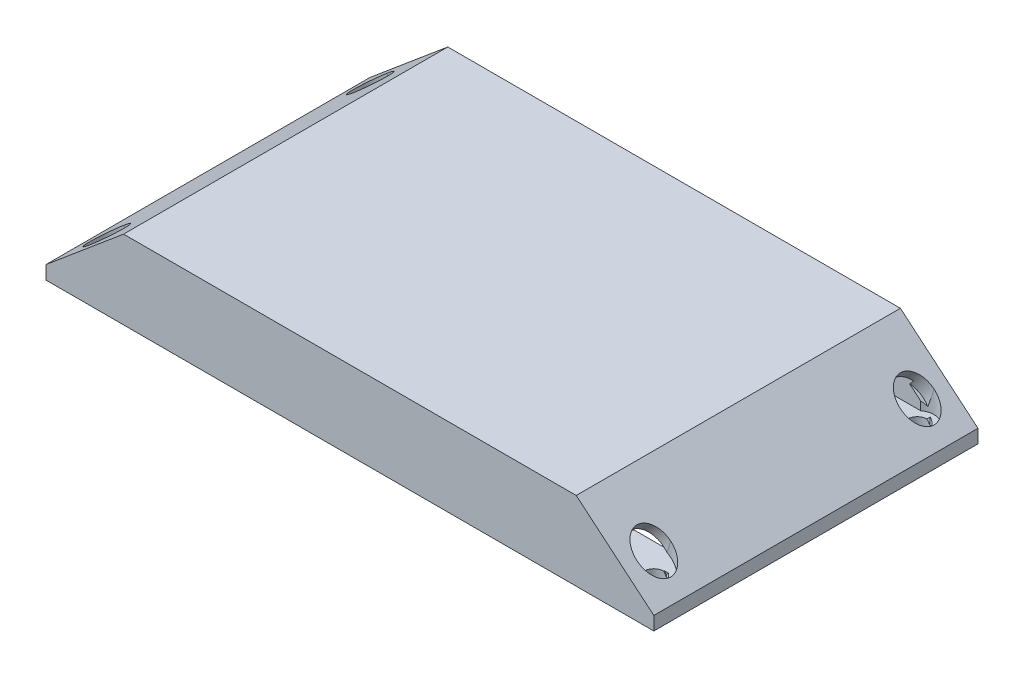
from build123d import *
from build123d.topology import SkipClean

# Parameters (mm, degrees)
SKICA1_W                 = 90
SKICA1_H                 = 48
SKICA1_W_2               = 85
SKICA1_H_2               = 43
P_IDAT_VYSUNUT_M1_DEPTH  = 2
P_IDAT_VYSUNUT_M2_DEPTH  = 2.5
P_IDAT_VYSUNUT_M3_DEPTH  = 43
P_IDAT_START             = -45.5
P_IDAT_VYSUNUT_M4_DEPTH  = 2.5
SKICA5_R                 = 2.5
SKICA5_R_2               = 1.4
P_IDAT_VYSUNUT_M5_DEPTH  = 6
ODEBRAT_START            = -3.5
SKICA6_R                 = 2.5
ODEBRAT_VYSUNUT_M1_DEPTH = 3.5
SKICA7_RX                = 3.26280462
SKICA7_RY                = 2.499223228
SKICA7_RX_2              = 3.263518223
SKICA7_RY_2              = 2.5
ODEBRAT_VYSUNUT_M2_DEPTH = 2.5
SKICA8_RX                = 3.263518223
SKICA8_RY                = 2.5
ODEBRAT_VYSUNUT_M3_DEPTH = 2.5
P_IDAT_VYSUNUT_M7_DEPTH  = 2.5
SKICA12_W                = 1.5
SKICA12_H                = 6.5
P_IDAT_VYSUNUT_M8_DEPTH  = 11.5


with BuildPart() as part:
    # Skica1 → Přidat vysunutím1 (new body)
    with BuildSketch(Plane(origin=(0, 0, 0), x_dir=(1, 0, 0), z_dir=(0, 1, 0))):
        with Locations((45, 24)):
            Rectangle(SKICA1_W, SKICA1_H)
        with Locations((45, 24)):
            Rectangle(SKICA1_W_2, SKICA1_H_2, mode=Mode.SUBTRACT)
    extrude(amount=P_IDAT_VYSUNUT_M1_DEPTH)

    # Skica2 → Přidat vysunutím2 (add)
    with BuildSketch(Plane.XY):
        Polygon((0, 2), (11.490666647, 11.641814145), (78.509333353, 11.641814145), (90, 2), align=None)
    extrude(amount=-P_IDAT_VYSUNUT_M2_DEPTH)

    # Skica3 → Přidat vysunutím3 (add)
    with BuildSketch(Plane(origin=(0, 0, -2.5), x_dir=(-1, 0, 0), z_dir=(0, 0, -1))):
        Polygon((-90, 2), (-78.509333353, 11.641814145), (-11.490666647, 11.641814145), (0, 2), (-2.5, 2), (-11.607159462, 9.641814145), (-78.392840538, 9.641814145), (-87.5, 2), align=None)
    extrude(amount=P_IDAT_VYSUNUT_M3_DEPTH)

    # Skica4 → Přidat vysunutím4 (add)
    with BuildSketch(Plane.XY.offset(P_IDAT_START)):
        Polygon((0, 2), (11.490666647, 11.641814145), (78.509333353, 11.641814145), (90, 2), align=None)
    extrude(amount=-P_IDAT_VYSUNUT_M4_DEPTH)

    # Skica5 → Přidat vysunutím5 (add)
    # profile 1 of 4: a face of its own
    with BuildSketch(Plane.XZ):
        with Locations((4.5, -4.5)):
            Circle(SKICA5_R)
        with Locations(Location((4.5, -4.5, 0), (0, 0, 270))):
            Circle(SKICA5_R_2, mode=Mode.SUBTRACT)
    # profile 2 of 4: a face of its own
    with BuildSketch(Plane.XZ):
        with Locations((4.5, -43.5)):
            Circle(SKICA5_R)
        with Locations(Location((4.5, -43.5, 0), (0, 0, 270))):
            Circle(SKICA5_R_2, mode=Mode.SUBTRACT)
    # profile 3 of 4: a face of its own
    with BuildSketch(Plane.XZ):
        with Locations((85.5, -4.5)):
            Circle(SKICA5_R)
        with Locations(Location((85.5, -4.5, 0), (0, 0, 270))):
            Circle(SKICA5_R_2, mode=Mode.SUBTRACT)
    # profile 4 of 4: a face of its own
    with BuildSketch(Plane.XZ):
        with Locations((85.5, -43.5)):
            Circle(SKICA5_R)
        with Locations(Location((85.5, -43.5, 0), (0, 0, 270))):
            Circle(SKICA5_R_2, mode=Mode.SUBTRACT)
    extrude(amount=-P_IDAT_VYSUNUT_M5_DEPTH)

    # Skica6 → Odebrat vysunutím1 (cut)
    with BuildSketch(Plane(origin=(0, 6, 0), x_dir=(1, 0, 0), z_dir=(0, 1, 0)).offset(ODEBRAT_START)):
        with Locations(Location((4.5, 43.5, 0), (0, 0, 276.131213433))):
            Circle(SKICA6_R)
        with Locations(Location((4.5, 4.5, 0), (0, 0, 276.131213433))):
            Circle(SKICA6_R)
        with Locations(Location((85.5, 4.5, 0), (0, 0, 263.868786567))):
            Circle(SKICA6_R)
        with Locations(Location((85.5, 43.5, 0), (0, 0, 263.868786567))):
            Circle(SKICA6_R)
    extrude(amount=ODEBRAT_VYSUNUT_M1_DEPTH, mode=Mode.SUBTRACT)

    # Skica7 → Odebrat vysunutím2 (cut)
    with SkipClean():  # the faces are left unmerged after this step: merging them gives an invalid solid
        with BuildSketch(Plane(origin=(-0.984807753, 1.173648178, 0), x_dir=(0.7660444431189767, 0.642787609686541, 0), z_dir=(-0.642787609686541, 0.7660444431189767, 0))):
            with Locations(Location((7.159908021, 4.5), (0, 0, 1.428320676))):
                Ellipse(SKICA7_RX, SKICA7_RY)
            with Locations((7.159908021, 43.5)):
                Ellipse(SKICA7_RX_2, SKICA7_RY_2)
        extrude(amount=-ODEBRAT_VYSUNUT_M2_DEPTH, mode=Mode.SUBTRACT)

    # Skica8 → Odebrat vysunutím3 (cut)
    with SkipClean():  # the faces are left unmerged after this step: merging them gives an invalid solid
        with BuildSketch(Plane(origin=(38.170639758, 45.489997063, 0), x_dir=(0.7660444431189819, -0.6427876096865348, 0), z_dir=(0.6427876096865348, 0.7660444431189819, 0))):
            with Locations((61.784091859, 43.5)):
                Ellipse(SKICA8_RX, SKICA8_RY)
            with Locations((61.784091859, 4.5)):
                Ellipse(SKICA8_RX, SKICA8_RY)
        extrude(amount=-ODEBRAT_VYSUNUT_M3_DEPTH, mode=Mode.SUBTRACT)

    # Skica10 → Přidat vysunutím7 (add)
    with BuildSketch(Plane.XZ):
        Polygon((2.5, -42), (6.5, -42), (6, -45.5), (13.5, -45.5), (13.5, -39), (2.5, -39), align=None)
        Polygon((2.5, -6), (6.519182209, -6), (6, -2.5), (13.5, -2.5), (13.5, -9), (2.5, -9), align=None)
        Polygon((87.5, -6), (83.5, -6), (84, -2.5), (76.5, -2.5), (76.5, -9), (87.5, -9), align=None)
        Polygon((87.5, -42), (83.5, -42), (84, -45.5), (76.5, -45.5), (76.5, -39), (87.5, -39), align=None)
    extrude(amount=-P_IDAT_VYSUNUT_M7_DEPTH)

    # Skica12 → Přidat vysunutím8 (add)
    with BuildSketch(Plane.XZ):
        with Locations((77.25, -5.75)):
            Rectangle(SKICA12_W, SKICA12_H)
        with Locations((77.25, -42.25)):
            Rectangle(SKICA12_W, SKICA12_H)
        with Locations((12.75, -42.25)):
            Rectangle(SKICA12_W, SKICA12_H)
        with Locations((12.75, -5.75)):
            Rectangle(SKICA12_W, SKICA12_H)
    extrude(amount=-P_IDAT_VYSUNUT_M8_DEPTH)


solid = part.part
